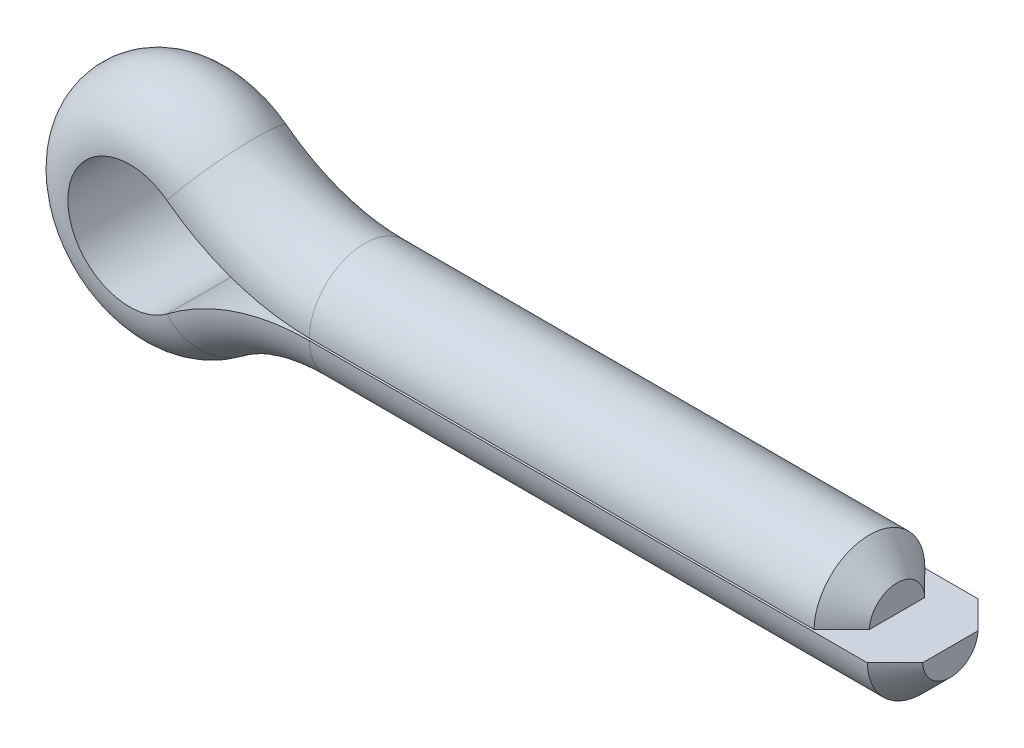
from build123d import *

# Parameters (mm, degrees)
CHAMFER1_SIZE = 0.6604


with BuildPart() as part:
    # Sweep1: sweep along a path in Sketch3
    with BuildLine(Plane.XY) as sweep1_path:
        Line((1.27, -0.0254), (-12.7, -0.0254))
        ThreePointArc((-12.7, -0.0254), (-14.489189865, -0.319578731), (-16.089996909, -1.171141007))
        ThreePointArc((-16.089996909, -1.171141007), (-18.456923366, 0), (-16.089996909, 1.171141007))
        ThreePointArc((-16.089996909, 1.171141007), (-14.489189865, 0.319578731), (-12.7, 0.0254))
        Line((-12.7, 0.0254), (0, 0.0254))
    # Sketch4 → Sweep1 (sweep)
    with BuildSketch(Plane(origin=(0, 0, 0), x_dir=(0, 0, -1), z_dir=(1, 0, 0))):
        with BuildLine():
            Line((-1.320555747, 0.0254), (1.320555747, 0.0254))
            ThreePointArc((1.320555747, 0.0254), (0, 1.3208), (-1.320555747, 0.0254))
        make_face()
    sweep(path=sweep1_path.line)

    # Chamfer1
    chamfer1_edges = [part.edges().sort_by_distance(p)[0] for p in [
        (0, 1.3208, 0),
        (1.27, -1.3208, 0),
    ]]
    chamfer(chamfer1_edges, length=CHAMFER1_SIZE)


solid = part.part
